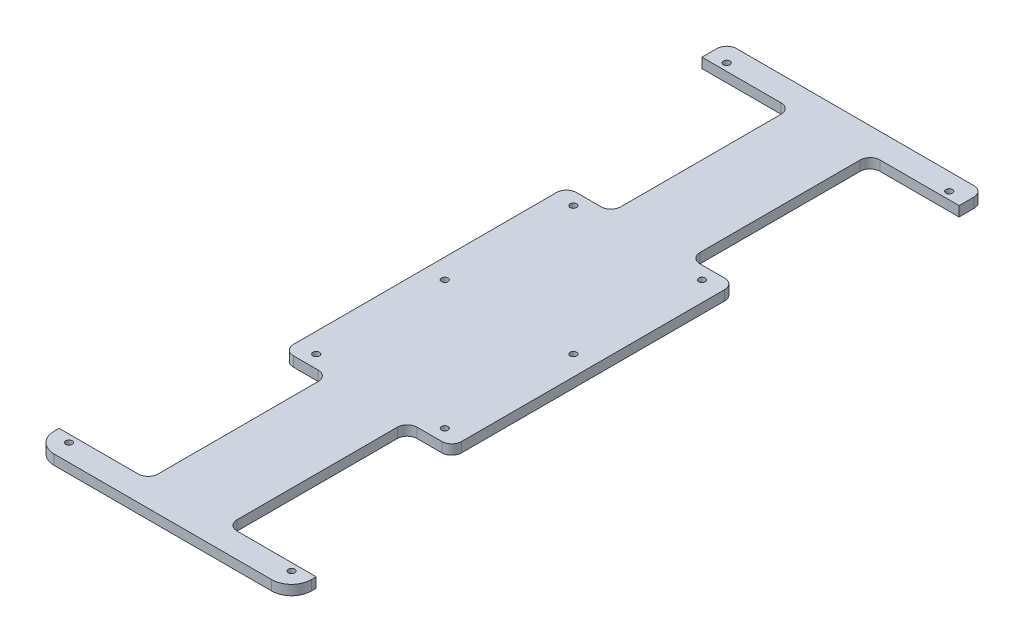
from build123d import *

# Parameters (mm, degrees)
BOSS_EXTRUDE1_DEPTH = 5
FILLET1_R           = 10
FILLET2_R           = 5
SKETCH2_R           = 1.65
CUT_EXTRUDE1_DEPTH  = 374.396572025
SKETCH3_R           = 1.65
CUT_EXTRUDE2_DEPTH  = 374.396572025
SKETCH4_R           = 1.65
CUT_EXTRUDE3_DEPTH  = 374.396572025
FILLET3_R           = 5


with BuildPart() as part:
    # Sketch1 → Boss-Extrude1 (new body)
    with BuildSketch(Plane(origin=(0, 0, 0), x_dir=(1, 0, 0), z_dir=(0, 1, 0))):
        Polygon((0, 0), (130, 0), (130, 12.5), (85, 12.5), (85, 103.5), (107.5, 103.5), (107.5, 246.5), (85, 246.5), (85, 337.5), (130, 337.5), (130, 350), (0, 350), (0, 337.5), (45, 337.5), (45, 246.5), (22.5, 246.5), (22.5, 103.5), (45, 103.5), (45, 12.5), (0, 12.5), align=None)
    extrude(amount=BOSS_EXTRUDE1_DEPTH)

    # Fillet1
    fillet1_edges = [part.edges().sort_by_distance(p)[0] for p in [
        (130, 2.5, 0),
        (0, 2.5, 0),
    ]]
    fillet(fillet1_edges, radius=FILLET1_R)

    # Fillet2
    fillet2_edges = [part.edges().sort_by_distance(p)[0] for p in [
        (22.5, 2.5, -103.5),
        (22.5, 2.5, -246.5),
        (0, 2.5, -350),
        (130, 2.5, -350),
        (107.5, 2.5, -246.5),
        (107.5, 2.5, -103.5),
    ]]
    fillet(fillet2_edges, radius=FILLET2_R)

    # Sketch2 → Cut-Extrude1 (cut, through all)
    with BuildSketch(Plane(origin=(0, 5, 0), x_dir=(1, 0, 0), z_dir=(0, 1, 0))):
        with Locations(Location((32.5, 240, 0), (0, 0, 270))):
            Circle(SKETCH2_R)
        with Locations(Location((32.5, 175, 0), (0, 0, 270))):
            Circle(SKETCH2_R)
        with Locations(Location((32.5, 110, 0), (0, 0, 270))):
            Circle(SKETCH2_R)
        with Locations(Location((97.5, 110, 0), (0, 0, 90))):
            Circle(SKETCH2_R)
        with Locations(Location((97.5, 175, 0), (0, 0, 90))):
            Circle(SKETCH2_R)
        with Locations(Location((97.5, 240, 0), (0, 0, 90))):
            Circle(SKETCH2_R)
    extrude(amount=-CUT_EXTRUDE1_DEPTH, mode=Mode.SUBTRACT)

    # Sketch3 → Cut-Extrude2 (cut, through all)
    with BuildSketch(Plane(origin=(0, 5, 0), x_dir=(1, 0, 0), z_dir=(0, 1, 0))):
        with Locations(Location((8.75, 8.75, 0), (0, 0, 270))):
            Circle(SKETCH3_R)
        with Locations(Location((121.25, 8.75, 0), (0, 0, 90))):
            Circle(SKETCH3_R)
    extrude(amount=-CUT_EXTRUDE2_DEPTH, mode=Mode.SUBTRACT)

    # Sketch4 → Cut-Extrude3 (cut, through all)
    with BuildSketch(Plane(origin=(0, 5, 0), x_dir=(1, 0, 0), z_dir=(0, 1, 0))):
        with Locations(Location((8.75, 341.25, 0), (0, 0, 270))):
            Circle(SKETCH4_R)
        with Locations(Location((121.25, 341.25, 0), (0, 0, 90))):
            Circle(SKETCH4_R)
    extrude(amount=-CUT_EXTRUDE3_DEPTH, mode=Mode.SUBTRACT)

    # Fillet3
    fillet3_edges = [part.edges().sort_by_distance(p)[0] for p in [
        (45, 2.5, -12.5),
        (45, 2.5, -103.5),
        (45, 2.5, -246.5),
        (45, 2.5, -337.5),
        (85, 2.5, -337.5),
        (85, 2.5, -246.5),
        (85, 2.5, -103.5),
        (85, 2.5, -12.5),
    ]]
    fillet(fillet3_edges, radius=FILLET3_R)


solid = part.part
